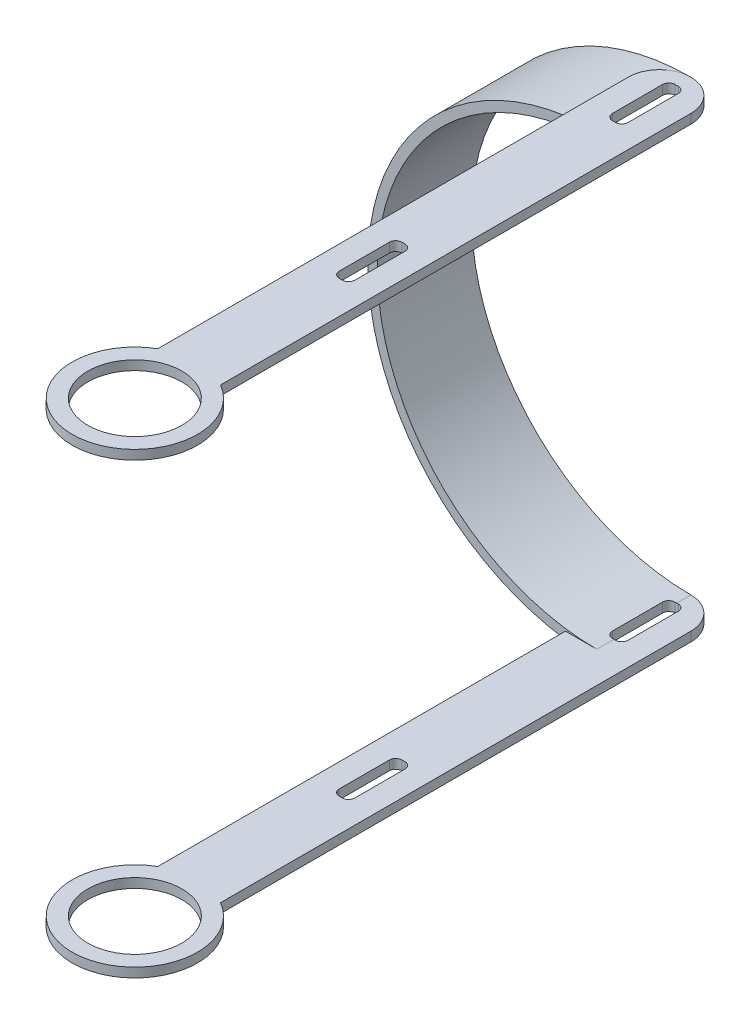
from build123d import *

# Parameters (mm, degrees)
SKETCH1_R           = 15
BOSS_EXTRUDE1_DEPTH = 3
BOSS_EXTRUDE5_DEPTH = 30
BOSS_EXTRUDE6_START = 3
SKETCH5_R           = 15
BOSS_EXTRUDE6_DEPTH = 3
CUT_EXTRUDE1_DEPTH  = 242.0136151


with BuildPart() as part:
    # Sketch1 → Boss-Extrude1 (new body)
    with BuildSketch(Plane(origin=(0, 0, 0), x_dir=(1, 0, 0), z_dir=(0, 1, 0))):
        with BuildLine():
            Line((-10, 167.320508076), (-10, 17.320508076))
            ThreePointArc((-10, 17.320508076), (0, -20), (10, 17.320508076))
            Line((10, 17.320508076), (10, 167.320508076))
            ThreePointArc((10, 167.320508076), (0, 177.320508076), (-10, 167.320508076))
        make_face()
        with Locations(Location((0, 0, 0), (0, 0, 270))):
            Circle(SKETCH1_R, mode=Mode.SUBTRACT)
    extrude(amount=BOSS_EXTRUDE1_DEPTH)

    # Sketch4 → Boss-Extrude5 (add)
    with BuildSketch(Plane(origin=(0, 0, -177.320508076), x_dir=(-1, 0, 0), z_dir=(0, 0, -1))):
        with BuildLine():
            Line((0, 0), (0, 3))
            ThreePointArc((0, 3), (70, 73), (0, 143))
            Line((0, 143), (0, 146))
            ThreePointArc((0, 146), (73, 73), (0, 0))
        make_face()
    extrude(amount=-BOSS_EXTRUDE5_DEPTH)

    # Sketch5 → Boss-Extrude6 (add)
    with BuildSketch(Plane(origin=(0, 146, 0), x_dir=(-1, 0, 0), z_dir=(0, -1, 0)).offset(BOSS_EXTRUDE6_START)):
        with BuildLine():
            Line((10, 17.320508076), (10, 167.320508076))
            ThreePointArc((10, 167.320508076), (0, 177.320508076), (-10, 167.320508076))
            Line((-10, 167.320508076), (-10, 17.320508076))
            ThreePointArc((-10, 17.320508076), (0, -20), (10, 17.320508076))
        make_face()
        with Locations(Location((0, 0, 0), (0, 0, 270))):
            Circle(SKETCH5_R, mode=Mode.SUBTRACT)
    extrude(amount=-BOSS_EXTRUDE6_DEPTH)

    # Sketch7 → Cut-Extrude1 (cut, through all)
    with BuildSketch(Plane(origin=(0, 146, 0), x_dir=(1, 0, 0), z_dir=(0, 1, 0))):
        with BuildLine():
            Line((0.5, 152.804939292), (-0.5, 152.804939292))
            ThreePointArc((-0.5, 152.804939292), (-1.914213562, 153.39072573), (-2.5, 154.804939292))
            Line((-2.5, 154.804939292), (-2.5, 170.804939292))
            ThreePointArc((-2.5, 170.804939292), (-1.914213562, 172.219152855), (-0.5, 172.804939292))
            Line((-0.5, 172.804939292), (0.5, 172.804939292))
            ThreePointArc((0.5, 172.804939292), (1.914213562, 172.219152855), (2.5, 170.804939292))
            Line((2.5, 170.804939292), (2.5, 154.804939292))
            ThreePointArc((2.5, 154.804939292), (1.914213562, 153.39072573), (0.5, 152.804939292))
        make_face()
        with BuildLine():
            Line((0.5, 65.676892474), (-0.5, 65.676892474))
            ThreePointArc((-0.5, 65.676892474), (-1.914213562, 66.262678911), (-2.5, 67.676892474))
            Line((-2.5, 67.676892474), (-2.5, 83.676892474))
            ThreePointArc((-2.5, 83.676892474), (-1.914213562, 85.091106036), (-0.5, 85.676892474))
            Line((-0.5, 85.676892474), (0.5, 85.676892474))
            ThreePointArc((0.5, 85.676892474), (1.914213562, 85.091106036), (2.5, 83.676892474))
            Line((2.5, 83.676892474), (2.5, 67.676892474))
            ThreePointArc((2.5, 67.676892474), (1.914213562, 66.262678911), (0.5, 65.676892474))
        make_face()
    extrude(amount=-CUT_EXTRUDE1_DEPTH, mode=Mode.SUBTRACT)


solid = part.part
